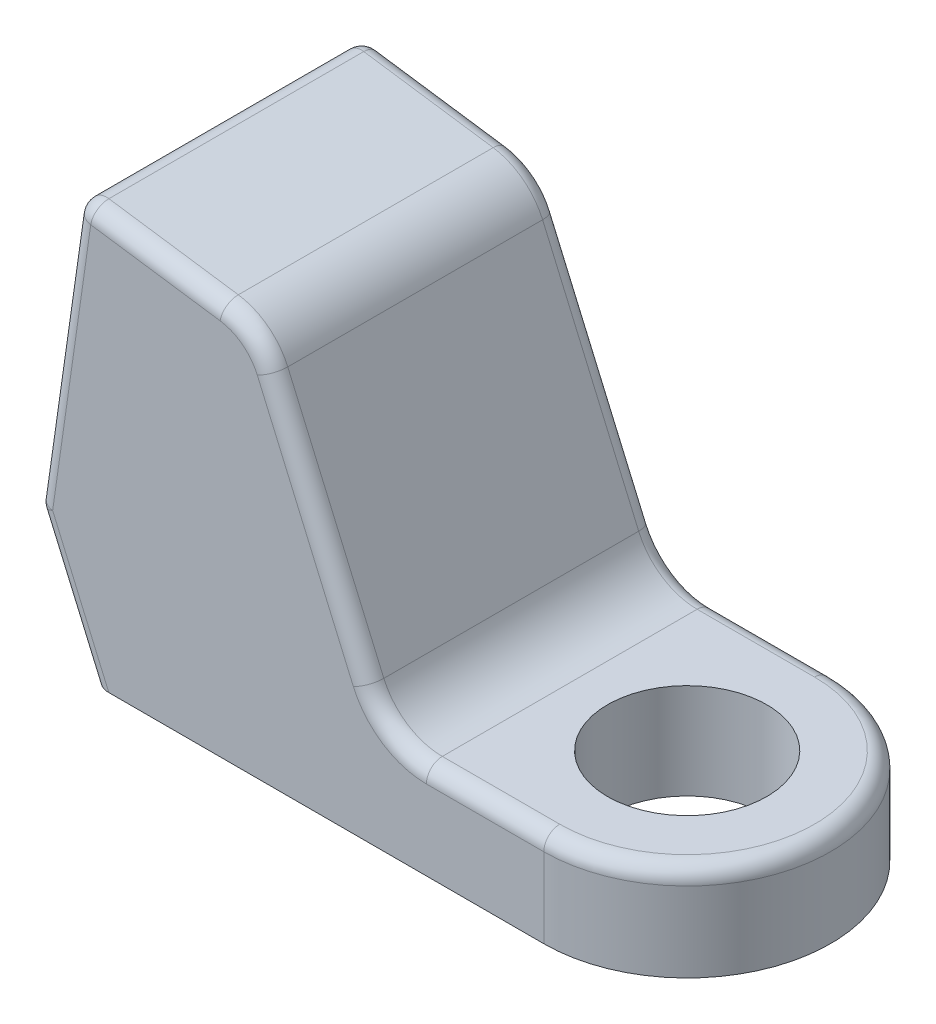
from build123d import *

# Parameters (mm, degrees)
SKETCH1_R           = 2.5
BOSS_EXTRUDE1_DEPTH = 3
SKETCH2_W           = 12.5
SKETCH2_H           = 9
BOSS_EXTRUDE2_DEPTH = 10
SKETCH3_W           = 2
SKETCH3_H           = 3
CUT_EXTRUDE1_DEPTH  = 9
CUT_EXTRUDE2_DEPTH  = 5
FILLET1_R           = 2
FILLET2_R           = 0.5


with BuildPart() as part:
    # Sketch1 → Boss-Extrude1 (new body)
    with BuildSketch(Plane(origin=(0, 0, 0), x_dir=(1, 0, 0), z_dir=(0, 1, 0))):
        with BuildLine():
            Line((-7.5, -4.5), (8, -4.5))
            ThreePointArc((8, -4.5), (12.5, 0), (8, 4.5))
            Line((8, 4.5), (-7.5, 4.5))
            Line((-7.5, 4.5), (-7.5, -4.5))
        make_face()
        with Locations(Location((8, 0, 0), (0, 0, 270))):
            Circle(SKETCH1_R, mode=Mode.SUBTRACT)
    extrude(amount=BOSS_EXTRUDE1_DEPTH)

    # Sketch2 → Boss-Extrude2 (add)
    with BuildSketch(Plane(origin=(0, 3, 0), x_dir=(1, 0, 0), z_dir=(0, 1, 0))):
        with Locations((-3.25, 0)):
            Rectangle(SKETCH2_W, SKETCH2_H)
    extrude(amount=BOSS_EXTRUDE2_DEPTH)

    # Sketch3 → Cut-Extrude1 (cut)
    with BuildSketch(Plane.XY.offset(4.5)):
        Polygon((-9.5, 3), (-7.5, 3), (-7.933333333, 4), (-7.933333333, 13), (-9.5, 13), align=None)
        Polygon((-7.933333333, 13), (-7.933333333, 4), (-6.647619425, 13), align=None)
        Polygon((-7.5, 0), (-6.2, 0), (-7.5, 3), align=None)
        with Locations((-8.5, 1.5)):
            Rectangle(SKETCH3_W, SKETCH3_H)
        Polygon((3, 13), (-6.647619425, 13), (-0.982644513, 12.190718107), (3, 3), align=None)
    extrude(amount=-CUT_EXTRUDE1_DEPTH, mode=Mode.SUBTRACT)

    # Sketch5 → Cut-Extrude2 (cut)
    with BuildSketch(Plane(origin=(-8.3346666, 1.190666308, 0), x_dir=(0, 0, 1), z_dir=(-0.9899494994718544, 0.14142131556248963, 0))):
        Polygon((0, 10.933541985), (-2.775501763, 9.596930781), (-3.460994088, 6.593592669), (-1.540287274, 4.185102504), (1.540287274, 4.185102504), (3.460994088, 6.593592669), (2.775501763, 9.596930781), align=None)
    extrude(amount=-CUT_EXTRUDE2_DEPTH, mode=Mode.SUBTRACT)

    # Fillet1
    fillet1_edges = [part.edges().sort_by_distance(p)[0] for p in [
        (3, 3, 0),
        (-0.982644513, 12.190718107, 0),
    ]]
    fillet(fillet1_edges, radius=FILLET1_R)

    # Fillet2
    fillet2_edges = [part.edges().sort_by_distance(p)[0] for p in [
        (6.156518848, 3, 4.5),
        (-1.159565612, 11.958901825, 4.5),
        (-1.159565612, 11.958901825, -4.5),
        (3.215410654, 3.328110388, -4.5),
        (3.215410654, 3.328110388, 4.5),
        (12.5, 3, 0),
        (6.156518848, 3, -4.5),
        (-7.066666667, 2, -4.5),
        (-7.933333333, 4, 0),
        (-7.066666667, 2, 4.5),
        (-7.290476379, 8.5, 4.5),
        (-7.290476379, 8.5, -4.5),
        (-6.647619425, 13, 0),
        (-4.368863316, 12.674463509, -4.5),
        (-4.368863316, 12.674463509, 4.5),
        (0.970043929, 7.684514009, 4.5),
        (0.970043929, 7.684514009, -4.5),
    ]]
    fillet(fillet2_edges, radius=FILLET2_R)


solid = part.part
